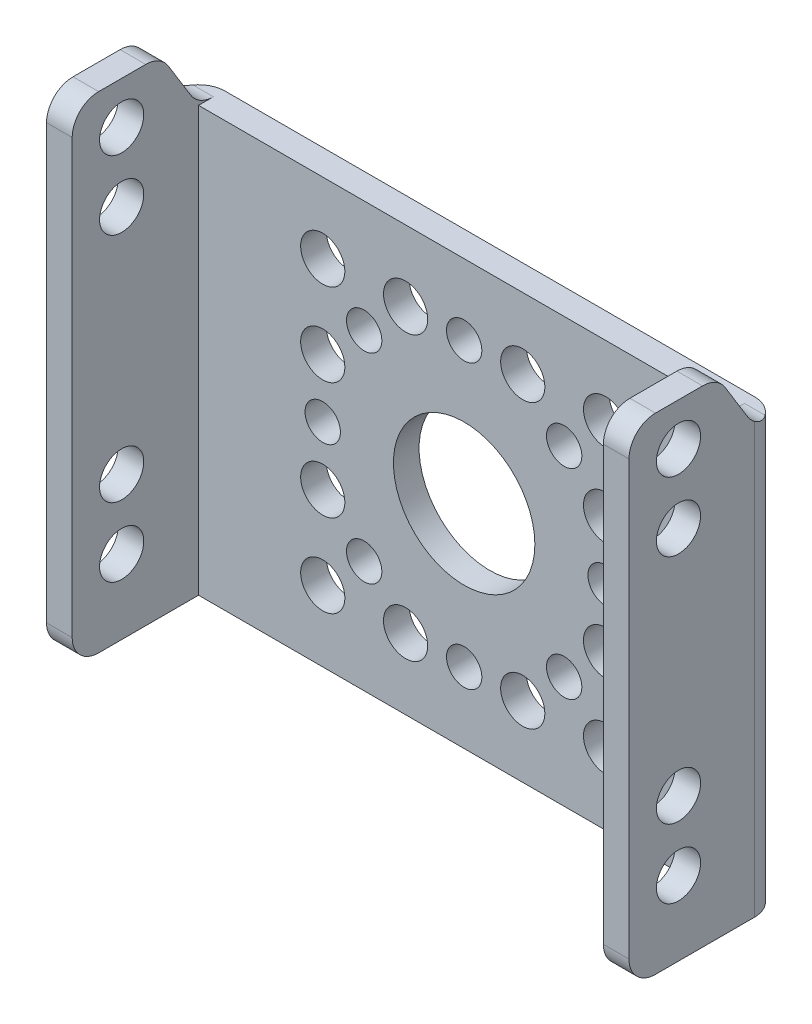
from build123d import *

# Parameters (mm, degrees)
SKETCH1_W           = 32.95
SKETCH1_H           = 24
BOSS_EXTRUDE1_DEPTH = 1.45
SKETCH3_R           = 4
CUT_EXTRUDE1_DEPTH  = 41.789765873
SKETCH4_R           = 1
CUT_EXTRUDE2_DEPTH  = 41.789765873
CIRPATTERN1_COUNT   = 8
SKETCH6_R           = 1.25
CUT_EXTRUDE3_DEPTH  = 1.45
SKETCH7_R           = 1.25
CUT_EXTRUDE4_DEPTH  = 1.45
CIRPATTERN2_COUNT   = 4
CIRPATTERN3_COUNT   = 8
SKETCH8_W           = 1.45
SKETCH8_H           = 27.5
BOSS_EXTRUDE2_DEPTH = 7.15
CUT_EXTRUDE5_REACH  = 45.771
SKETCH9_W           = 2.15
SKETCH9_H           = 3.5
BOSS_EXTRUDE3_DEPTH = 1.45
FILLET1_R           = 1.5
FILLET2_R           = 1.5
SKETCH12_R          = 1.25
CUT_EXTRUDE6_DEPTH  = 1.5
SKETCH13_R          = 1.25
CUT_EXTRUDE7_DEPTH  = 1.5
SKETCH14_R          = 1.25
CUT_EXTRUDE8_DEPTH  = 1.5
SKETCH15_R          = 1.25
CUT_EXTRUDE9_DEPTH  = 1.5
BOSS_EXTRUDE5_DEPTH = 1.45
FILLET3_R           = 1.5
FILLET4_R           = 1.5


with BuildPart() as part:
    # Sketch1 → Boss-Extrude1 (new body)
    with BuildSketch(Plane.XY):
        with Locations((16.475, 12)):
            Rectangle(SKETCH1_W, SKETCH1_H)
    extrude(amount=BOSS_EXTRUDE1_DEPTH)

    # Sketch3 → Cut-Extrude1 (cut, through all)
    with BuildSketch(Plane.XY.offset(1.45)):
        with Locations((16.475, 12)):
            Circle(SKETCH3_R)
    extrude(amount=-CUT_EXTRUDE1_DEPTH, mode=Mode.SUBTRACT)

    # Sketch4 → Cut-Extrude2 (cut, through all)
    with BuildSketch(Plane.XY.offset(1.45)):
        with Locations((16.475, 20)):
            Circle(SKETCH4_R)
    cut_extrude2 = extrude(amount=-CUT_EXTRUDE2_DEPTH, mode=Mode.SUBTRACT)

    # CirPattern1: Cut-Extrude2 ×8 about axis
    cirpattern1_axis = Axis((16.475, 12, 0), (0, 0, 1))
    for i in range(1, CIRPATTERN1_COUNT):
        add(cut_extrude2.rotate(cirpattern1_axis, i * 360 / CIRPATTERN1_COUNT), mode=Mode.SUBTRACT)

    # Sketch6 → Cut-Extrude3 (cut)
    with BuildSketch(Plane.XY.offset(1.45)):
        with Locations((24.475, 15.312868697)):
            Circle(SKETCH6_R)
    cut_extrude3 = extrude(amount=-CUT_EXTRUDE3_DEPTH, mode=Mode.SUBTRACT)

    # Sketch7 → Cut-Extrude4 (cut)
    with BuildSketch(Plane.XY.offset(1.45)):
        with Locations((24.475, 20)):
            Circle(SKETCH7_R)
    cut_extrude4 = extrude(amount=-CUT_EXTRUDE4_DEPTH, mode=Mode.SUBTRACT)

    # CirPattern2: Cut-Extrude4 ×4 about axis
    cirpattern2_axis = Axis((16.475, 12, 0), (0, 0, 1))
    for i in range(1, CIRPATTERN2_COUNT):
        add(cut_extrude4.rotate(cirpattern2_axis, i * 360 / CIRPATTERN2_COUNT), mode=Mode.SUBTRACT)

    # CirPattern3: Cut-Extrude3 ×8 about axis
    cirpattern3_axis = Axis((16.475, 12, 0), (0, 0, 1))
    for i in range(1, CIRPATTERN3_COUNT):
        add(cut_extrude3.rotate(cirpattern3_axis, i * 360 / CIRPATTERN3_COUNT), mode=Mode.SUBTRACT)

    # Sketch8 → Boss-Extrude2 (add)
    with BuildSketch(Plane.XY.offset(1.45)):
        with Locations((0.725, 13.75)):
            Rectangle(SKETCH8_W, SKETCH8_H)
    boss_extrude2 = extrude(amount=BOSS_EXTRUDE2_DEPTH)

    # Sketch9 → Cut-Extrude5 (cut, up to next)
    with BuildSketch(Plane.ZY, mode=Mode.PRIVATE) as cut_extrude5_sk1:
        with Locations((2.525, 25.75)):
            Rectangle(SKETCH9_W, SKETCH9_H)
    cut_extrude5_tool1 = extrude(cut_extrude5_sk1.sketch, amount=-CUT_EXTRUDE5_REACH, mode=Mode.PRIVATE) & part.part
    cut_extrude5 = cut_extrude5_tool1.solids().sort_by_distance((0, 25.75, 2.525))[0]
    add(cut_extrude5, mode=Mode.SUBTRACT)

    # Sketch11 → Boss-Extrude3 (add)
    with BuildSketch(Plane(origin=(1.45, 0, 0), x_dir=(0, 0, -1), z_dir=(1, 0, 0))):
        Polygon((-3.6, 27.5), (-1.45, 24), (-3.6, 24), align=None)
    extrude(amount=-BOSS_EXTRUDE3_DEPTH)

    # Fillet1
    fillet1_edges = [part.edges().sort_by_distance(p)[0] for p in [
        (0.725, 0, 8.6),
        (0.725, 27.5, 8.6),
        (0.725, 27.5, 3.6),
        (0.725, 24, 1.45),
    ]]
    fillet(fillet1_edges, radius=FILLET1_R)

    # Fillet2
    fillet2_edges = [part.edges().sort_by_distance(p)[0] for p in [
        (0, 12, 0),
    ]]
    fillet(fillet2_edges, radius=FILLET2_R)

    # Sketch12 → Cut-Extrude6 (cut)
    with BuildSketch(Plane.ZY):
        with Locations((5.8, 4.2)):
            Circle(SKETCH12_R)
    cut_extrude6 = extrude(amount=-CUT_EXTRUDE6_DEPTH, mode=Mode.SUBTRACT)

    # Sketch13 → Cut-Extrude7 (cut)
    with BuildSketch(Plane.ZY):
        with Locations((5.8, 21.2)):
            Circle(SKETCH13_R)
    cut_extrude7 = extrude(amount=-CUT_EXTRUDE7_DEPTH, mode=Mode.SUBTRACT)

    # Sketch14 → Cut-Extrude8 (cut)
    with BuildSketch(Plane.ZY):
        with Locations((5.8, 25.1)):
            Circle(SKETCH14_R)
    cut_extrude8 = extrude(amount=-CUT_EXTRUDE8_DEPTH, mode=Mode.SUBTRACT)

    # Sketch15 → Cut-Extrude9 (cut)
    with BuildSketch(Plane.ZY):
        with Locations((5.8, 8.1)):
            Circle(SKETCH15_R)
    cut_extrude9 = extrude(amount=-CUT_EXTRUDE9_DEPTH, mode=Mode.SUBTRACT)

    # Mirror3: Boss-Extrude2 across plane
    add(boss_extrude2.mirror(Plane(origin=(16.475, 0, 0), x_dir=(0, 0, 1), z_dir=(1, 0, 0))))

    # Mirror5: Cut-Extrude5 across plane
    add(cut_extrude5.mirror(Plane(origin=(16.475, 0, 0), x_dir=(0, 0, 1), z_dir=(1, 0, 0))), mode=Mode.SUBTRACT)

    # Sketch17 → Boss-Extrude5 (add)
    with BuildSketch(Plane.ZY.offset(-31.5)):
        Polygon((1.45, 24), (3.6, 27.5), (3.6, 24), align=None)
    extrude(amount=-BOSS_EXTRUDE5_DEPTH)

    # Mirror8: Cut-Extrude6, Cut-Extrude7, Cut-Extrude8, Cut-Extrude9 across plane
    add(cut_extrude6.mirror(Plane(origin=(16.475, 0, 0), x_dir=(0, 0, 1), z_dir=(1, 0, 0))), mode=Mode.SUBTRACT)
    add(cut_extrude7.mirror(Plane(origin=(16.475, 0, 0), x_dir=(0, 0, 1), z_dir=(1, 0, 0))), mode=Mode.SUBTRACT)
    add(cut_extrude8.mirror(Plane(origin=(16.475, 0, 0), x_dir=(0, 0, 1), z_dir=(1, 0, 0))), mode=Mode.SUBTRACT)
    add(cut_extrude9.mirror(Plane(origin=(16.475, 0, 0), x_dir=(0, 0, 1), z_dir=(1, 0, 0))), mode=Mode.SUBTRACT)

    # Fillet3
    fillet3_edges = [part.edges().sort_by_distance(p)[0] for p in [
        (32.225, 27.5, 8.6),
        (32.225, 0, 8.6),
        (32.225, 27.5, 3.6),
        (32.225, 24, 1.45),
    ]]
    fillet(fillet3_edges, radius=FILLET3_R)

    # Fillet4
    fillet4_edges = [part.edges().sort_by_distance(p)[0] for p in [
        (32.95, 12, 0),
    ]]
    fillet(fillet4_edges, radius=FILLET4_R)


solid = part.part
